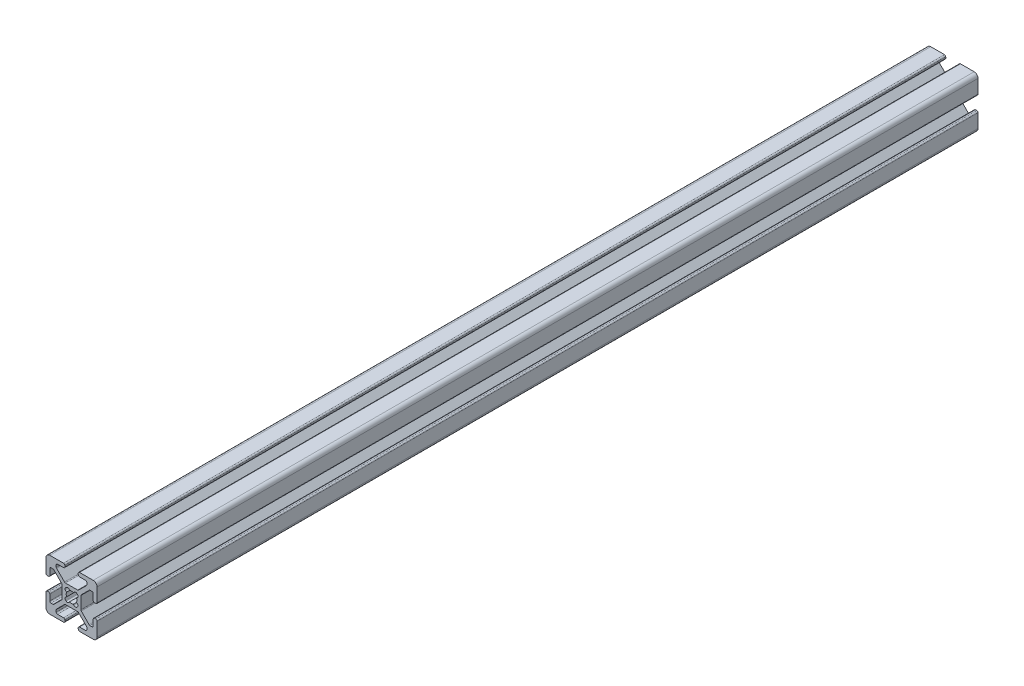
from build123d import *

# Parameters (mm, degrees)
EXTRUDE1_DEPTH = 345


with BuildPart() as part:
    # Sketch1 → Extrude1 (new body)
    with BuildSketch(Plane.XY):
        with BuildLine():
            Line((9.492, 2.63), (9.008, 2.63))
            ThreePointArc((9.008, 2.63), (8.648789755, 2.778789755), (8.5, 3.138))
            Line((8.5, 3.138), (8.5, 5.487))
            ThreePointArc((8.5, 5.487), (8.351210245, 5.846210245), (7.992, 5.995))
            Line((7.992, 5.995), (7.266080661, 5.995))
            ThreePointArc((7.266080661, 5.995), (7.071677478, 5.956330803), (6.906870417, 5.846210245))
            Line((6.906870417, 5.846210245), (3.803789755, 2.743129583))
            ThreePointArc((3.803789755, 2.743129583), (3.693669197, 2.578322522), (3.655, 2.383919339))
            Line((3.655, 2.383919339), (3.655, -2.383919339))
            ThreePointArc((3.655, -2.383919339), (3.693669197, -2.578322522), (3.803789755, -2.743129583))
            Line((3.803789755, -2.743129583), (6.906870417, -5.846210245))
            ThreePointArc((6.906870417, -5.846210245), (7.071677478, -5.956330803), (7.266080661, -5.995))
            Line((7.266080661, -5.995), (7.992, -5.995))
            ThreePointArc((7.992, -5.995), (8.351210245, -5.846210245), (8.5, -5.487))
            Line((8.5, -5.487), (8.5, -3.138))
            ThreePointArc((8.5, -3.138), (8.648789755, -2.778789755), (9.008, -2.63))
            Line((9.008, -2.63), (9.492, -2.63))
            ThreePointArc((9.492, -2.63), (9.851210245, -2.778789755), (10, -3.138))
            Line((10, -3.138), (10, -8.5))
            ThreePointArc((10, -8.5), (9.560660172, -9.560660172), (8.5, -10))
            Line((8.5, -10), (3.138, -10))
            ThreePointArc((3.138, -10), (2.778789755, -9.851210245), (2.63, -9.492))
            Line((2.63, -9.492), (2.63, -9.008))
            ThreePointArc((2.63, -9.008), (2.778789755, -8.648789755), (3.138, -8.5))
            Line((3.138, -8.5), (5.487, -8.5))
            ThreePointArc((5.487, -8.5), (5.846210245, -8.351210245), (5.995, -7.992))
            Line((5.995, -7.992), (5.995, -7.266080661))
            ThreePointArc((5.995, -7.266080661), (5.956330803, -7.071677478), (5.846210245, -6.906870417))
            Line((5.846210245, -6.906870417), (2.743129583, -3.803789755))
            ThreePointArc((2.743129583, -3.803789755), (2.578322522, -3.693669197), (2.383919339, -3.655))
            Line((2.383919339, -3.655), (-2.383919339, -3.655))
            ThreePointArc((-2.383919339, -3.655), (-2.578322522, -3.693669197), (-2.743129583, -3.803789755))
            Line((-2.743129583, -3.803789755), (-5.846210245, -6.906870417))
            ThreePointArc((-5.846210245, -6.906870417), (-5.956330803, -7.071677478), (-5.995, -7.266080661))
            Line((-5.995, -7.266080661), (-5.995, -7.992))
            ThreePointArc((-5.995, -7.992), (-5.846210245, -8.351210245), (-5.487, -8.5))
            Line((-5.487, -8.5), (-3.138, -8.5))
            ThreePointArc((-3.138, -8.5), (-2.778789755, -8.648789755), (-2.63, -9.008))
            Line((-2.63, -9.008), (-2.63, -9.492))
            ThreePointArc((-2.63, -9.492), (-2.778789755, -9.851210245), (-3.138, -10))
            Line((-3.138, -10), (-8.5, -10))
            ThreePointArc((-8.5, -10), (-9.560660172, -9.560660172), (-10, -8.5))
            Line((-10, -8.5), (-10, -3.138))
            ThreePointArc((-10, -3.138), (-9.851210245, -2.778789755), (-9.492, -2.63))
            Line((-9.492, -2.63), (-9.008, -2.63))
            ThreePointArc((-9.008, -2.63), (-8.648789755, -2.778789755), (-8.5, -3.138))
            Line((-8.5, -3.138), (-8.5, -5.487))
            ThreePointArc((-8.5, -5.487), (-8.351210245, -5.846210245), (-7.992, -5.995))
            Line((-7.992, -5.995), (-7.266080661, -5.995))
            ThreePointArc((-7.266080661, -5.995), (-7.071677478, -5.956330803), (-6.906870417, -5.846210245))
            Line((-6.906870417, -5.846210245), (-3.803789755, -2.743129583))
            ThreePointArc((-3.803789755, -2.743129583), (-3.693669197, -2.578322522), (-3.655, -2.383919339))
            Line((-3.655, -2.383919339), (-3.655, 2.383919339))
            ThreePointArc((-3.655, 2.383919339), (-3.693669197, 2.578322522), (-3.803789755, 2.743129583))
            Line((-3.803789755, 2.743129583), (-6.906870417, 5.846210245))
            ThreePointArc((-6.906870417, 5.846210245), (-7.071677478, 5.956330803), (-7.266080661, 5.995))
            Line((-7.266080661, 5.995), (-7.992, 5.995))
            ThreePointArc((-7.992, 5.995), (-8.351210245, 5.846210245), (-8.5, 5.487))
            Line((-8.5, 5.487), (-8.5, 3.138))
            ThreePointArc((-8.5, 3.138), (-8.648789755, 2.778789755), (-9.008, 2.63))
            Line((-9.008, 2.63), (-9.492, 2.63))
            ThreePointArc((-9.492, 2.63), (-9.851210245, 2.778789755), (-10, 3.138))
            Line((-10, 3.138), (-10, 8.5))
            ThreePointArc((-10, 8.5), (-9.560660172, 9.560660172), (-8.5, 10))
            Line((-8.5, 10), (-3.138, 10))
            ThreePointArc((-3.138, 10), (-2.778789755, 9.851210245), (-2.63, 9.492))
            Line((-2.63, 9.492), (-2.63, 9.008))
            ThreePointArc((-2.63, 9.008), (-2.778789755, 8.648789755), (-3.138, 8.5))
            Line((-3.138, 8.5), (-5.487, 8.5))
            ThreePointArc((-5.487, 8.5), (-5.846210245, 8.351210245), (-5.995, 7.992))
            Line((-5.995, 7.992), (-5.995, 7.266080661))
            ThreePointArc((-5.995, 7.266080661), (-5.956330803, 7.071677478), (-5.846210245, 6.906870417))
            Line((-5.846210245, 6.906870417), (-2.743129583, 3.803789755))
            ThreePointArc((-2.743129583, 3.803789755), (-2.578322522, 3.693669197), (-2.383919339, 3.655))
            Line((-2.383919339, 3.655), (2.383919339, 3.655))
            ThreePointArc((2.383919339, 3.655), (2.578322522, 3.693669197), (2.743129583, 3.803789755))
            Line((2.743129583, 3.803789755), (5.846210245, 6.906870417))
            ThreePointArc((5.846210245, 6.906870417), (5.956330803, 7.071677478), (5.995, 7.266080661))
            Line((5.995, 7.266080661), (5.995, 7.992))
            ThreePointArc((5.995, 7.992), (5.846210245, 8.351210245), (5.487, 8.5))
            Line((5.487, 8.5), (3.138, 8.5))
            ThreePointArc((3.138, 8.5), (2.778789755, 8.648789755), (2.63, 9.008))
            Line((2.63, 9.008), (2.63, 9.492))
            ThreePointArc((2.63, 9.492), (2.778789755, 9.851210245), (3.138, 10))
            Line((3.138, 10), (8.5, 10))
            ThreePointArc((8.5, 10), (9.560660172, 9.560660172), (10, 8.5))
            Line((10, 8.5), (10, 3.138))
            ThreePointArc((10, 3.138), (9.851210245, 2.778789755), (9.492, 2.63))
        make_face()
        with BuildLine():
            Line((2.124900844, -2.304505966), (2.304505966, -2.124900844))
            ThreePointArc((2.304505966, -2.124900844), (2.505938017, -1.356467811), (1.935133506, -0.803976718))
            ThreePointArc((1.935133506, -0.803976718), (2.0955, 0), (1.935133506, 0.803976718))
            ThreePointArc((1.935133506, 0.803976718), (2.505938017, 1.356467811), (2.304505966, 2.124900844))
            Line((2.304505966, 2.124900844), (2.124900844, 2.304505966))
            ThreePointArc((2.124900844, 2.304505966), (1.356467811, 2.505938017), (0.803976718, 1.935133506))
            ThreePointArc((0.803976718, 1.935133506), (0, 2.0955), (-0.803976718, 1.935133506))
            ThreePointArc((-0.803976718, 1.935133506), (-1.356467811, 2.505938017), (-2.124900844, 2.304505966))
            Line((-2.124900844, 2.304505966), (-2.304505966, 2.124900844))
            ThreePointArc((-2.304505966, 2.124900844), (-2.505938017, 1.356467811), (-1.935133506, 0.803976718))
            ThreePointArc((-1.935133506, 0.803976718), (-2.0955, 0), (-1.935133506, -0.803976718))
            ThreePointArc((-1.935133506, -0.803976718), (-2.505938017, -1.356467811), (-2.304505966, -2.124900844))
            Line((-2.304505966, -2.124900844), (-2.124900844, -2.304505966))
            ThreePointArc((-2.124900844, -2.304505966), (-1.356467811, -2.505938017), (-0.803976718, -1.935133506))
            ThreePointArc((-0.803976718, -1.935133506), (0, -2.0955), (0.803976718, -1.935133506))
            ThreePointArc((0.803976718, -1.935133506), (1.356467811, -2.505938017), (2.124900844, -2.304505966))
        make_face(mode=Mode.SUBTRACT)
    extrude(amount=-EXTRUDE1_DEPTH)


solid = part.part
